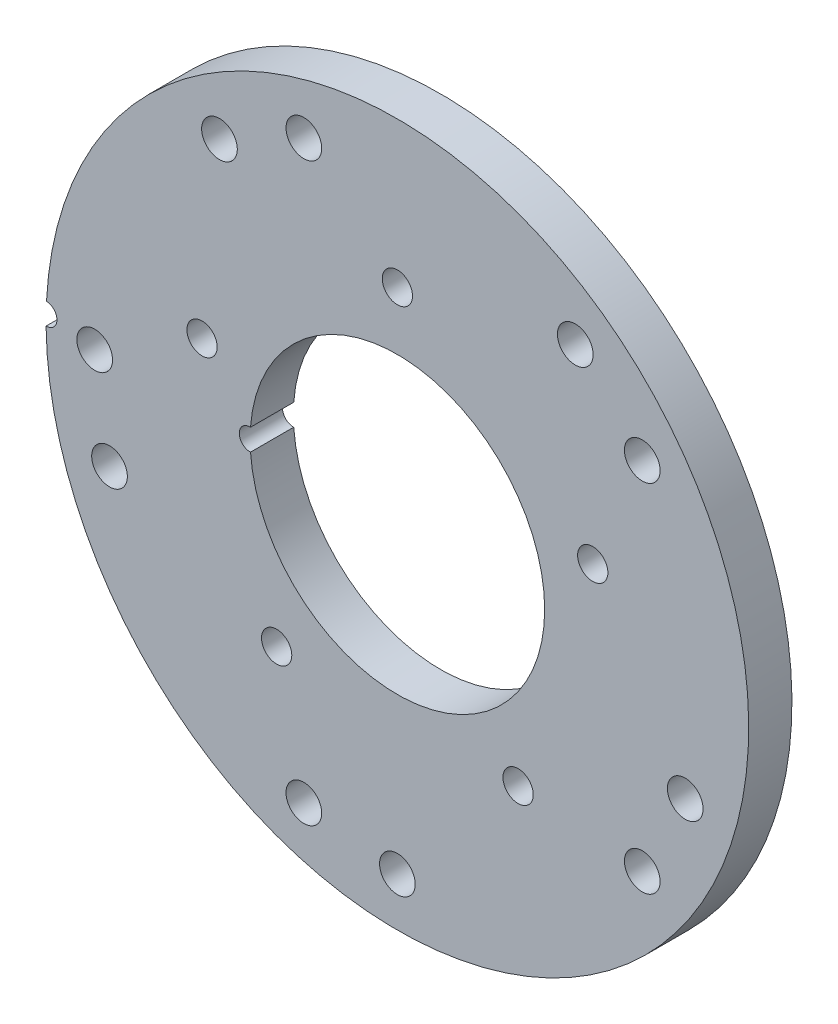
from build123d import *

# Parameters (mm, degrees)
SKETCH_1_R          = 32.5
SKETCH_1_R_2        = 13.625
SKETCH_1_R_3        = 1.65
SKETCH_1_R_4        = 1.4
EXTRUDE_1_DEPTH     = 4
SKETCH_2_R          = 1
CUT_EXTRUDE_1_DEPTH = 10


with BuildPart() as part:
    # 草图1 → 凸台-拉伸1 (new body)
    with BuildSketch(Plane.XY):
        Circle(SKETCH_1_R)
        Circle(SKETCH_1_R_2, mode=Mode.SUBTRACT)
        with Locations((0, -28)):
            Circle(SKETCH_1_R_3, mode=Mode.SUBTRACT)
        with Locations((-26.629582456, -8.652475842)):
            Circle(SKETCH_1_R_3, mode=Mode.SUBTRACT)
        with Locations((-16.457987064, 22.652475842)):
            Circle(SKETCH_1_R_3, mode=Mode.SUBTRACT)
        with Locations((16.457987064, 22.652475842)):
            Circle(SKETCH_1_R_3, mode=Mode.SUBTRACT)
        with Locations((26.629582456, -8.652475842)):
            Circle(SKETCH_1_R_3, mode=Mode.SUBTRACT)
        with Locations((-11.167919794, -15.371322893)):
            Circle(SKETCH_1_R_4, mode=Mode.SUBTRACT)
        with Locations((-18.07007381, 5.871322893)):
            Circle(SKETCH_1_R_4, mode=Mode.SUBTRACT)
        with Locations((0, 19)):
            Circle(SKETCH_1_R_4, mode=Mode.SUBTRACT)
        with Locations((18.07007381, 5.871322893)):
            Circle(SKETCH_1_R_4, mode=Mode.SUBTRACT)
        with Locations((11.167919794, -15.371322893)):
            Circle(SKETCH_1_R_4, mode=Mode.SUBTRACT)
        with Locations((-8.652475842, -26.629582456)):
            Circle(SKETCH_1_R_3, mode=Mode.SUBTRACT)
        with Locations((-28, 0)):
            Circle(SKETCH_1_R_3, mode=Mode.SUBTRACT)
        with Locations((-8.652475842, 26.629582456)):
            Circle(SKETCH_1_R_3, mode=Mode.SUBTRACT)
        with Locations((22.652475842, 16.457987064)):
            Circle(SKETCH_1_R_3, mode=Mode.SUBTRACT)
        with Locations((22.652475842, -16.457987064)):
            Circle(SKETCH_1_R_3, mode=Mode.SUBTRACT)
    extrude(amount=EXTRUDE_1_DEPTH)

    # 草图2 → 切除-拉伸1 (cut)
    with BuildSketch(Plane.XY.offset(4)):
        with Locations((-13.625, 0)):
            Circle(SKETCH_2_R)
        with Locations((-32.49354651, 0.647638152)):
            Circle(SKETCH_2_R)
    extrude(amount=-CUT_EXTRUDE_1_DEPTH, mode=Mode.SUBTRACT)


solid = part.part
